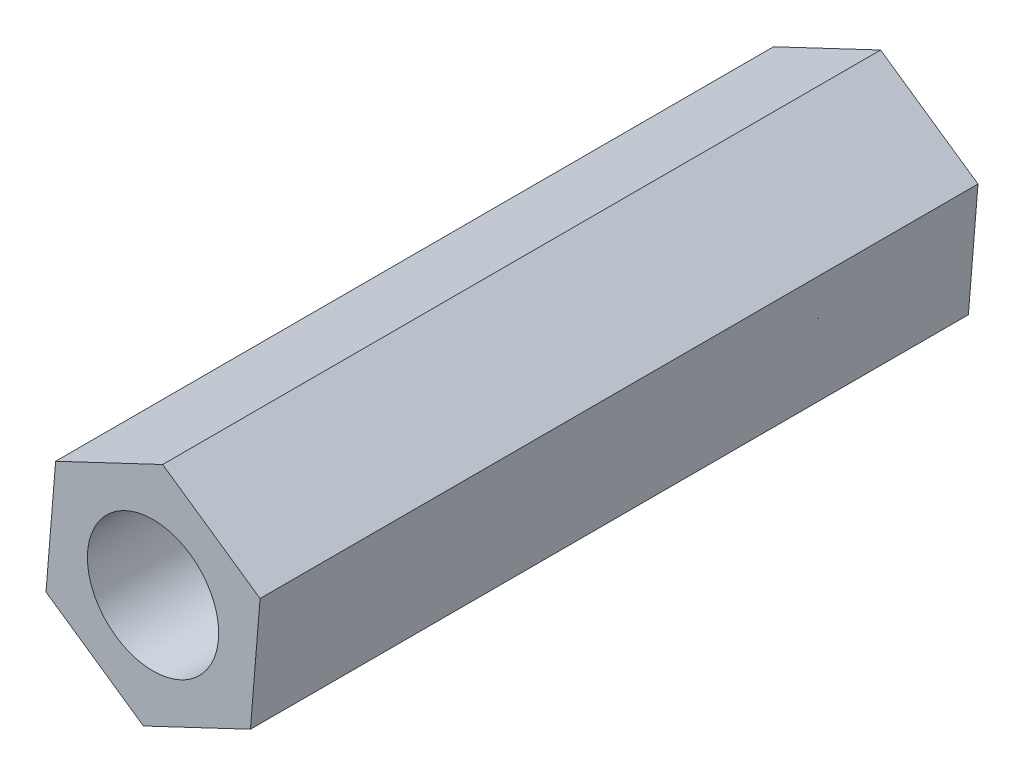
from build123d import *

# Parameters (mm, degrees)
BOSS_EXTRUDE1_DEPTH = 5
SKETCH2_R           = 1.6
CUT_EXTRUDE1_DEPTH  = 5
BOSS_EXTRUDE2_DEPTH = 12.5
CUT_EXTRUDE2_START  = -12.5
SKETCH4_R           = 1.6
CUT_EXTRUDE2_DEPTH  = 12.5


with BuildPart() as part:
    # Sketch1 → Boss-Extrude1 (new body)
    with BuildSketch(Plane.XY):
        Polygon((-2.374519268, 1.641642951), (-2.608964134, -1.235572533), (-0.234444865, -2.877215483), (2.374519268, -1.641642951), (2.608964134, 1.235572533), (0.234444865, 2.877215483), align=None)
    extrude(amount=BOSS_EXTRUDE1_DEPTH)

    # Sketch2 → Cut-Extrude1 (cut)
    with BuildSketch(Plane.XY.offset(5)):
        Circle(SKETCH2_R)
    extrude(amount=-CUT_EXTRUDE1_DEPTH, mode=Mode.SUBTRACT)

    # Sketch3 → Boss-Extrude2 (add)
    with BuildSketch(Plane.XY.offset(5)):
        Polygon((-0.234444865, -2.877215483), (2.374519268, -1.641642951), (2.608964134, 1.235572533), (0.234444865, 2.877215483), (-2.374519268, 1.641642951), (-2.608964134, -1.235572533), align=None)
    extrude(amount=BOSS_EXTRUDE2_DEPTH)

    # Sketch4 → Cut-Extrude2 (cut)
    with BuildSketch(Plane(origin=(0, 0, 5), x_dir=(-1, 0, 0), z_dir=(0, 0, -1)).offset(CUT_EXTRUDE2_START)):
        with Locations(Location((0, 0, 0), (0, 0, 180))):
            Circle(SKETCH4_R)
    extrude(amount=CUT_EXTRUDE2_DEPTH, mode=Mode.SUBTRACT)


solid = part.part
